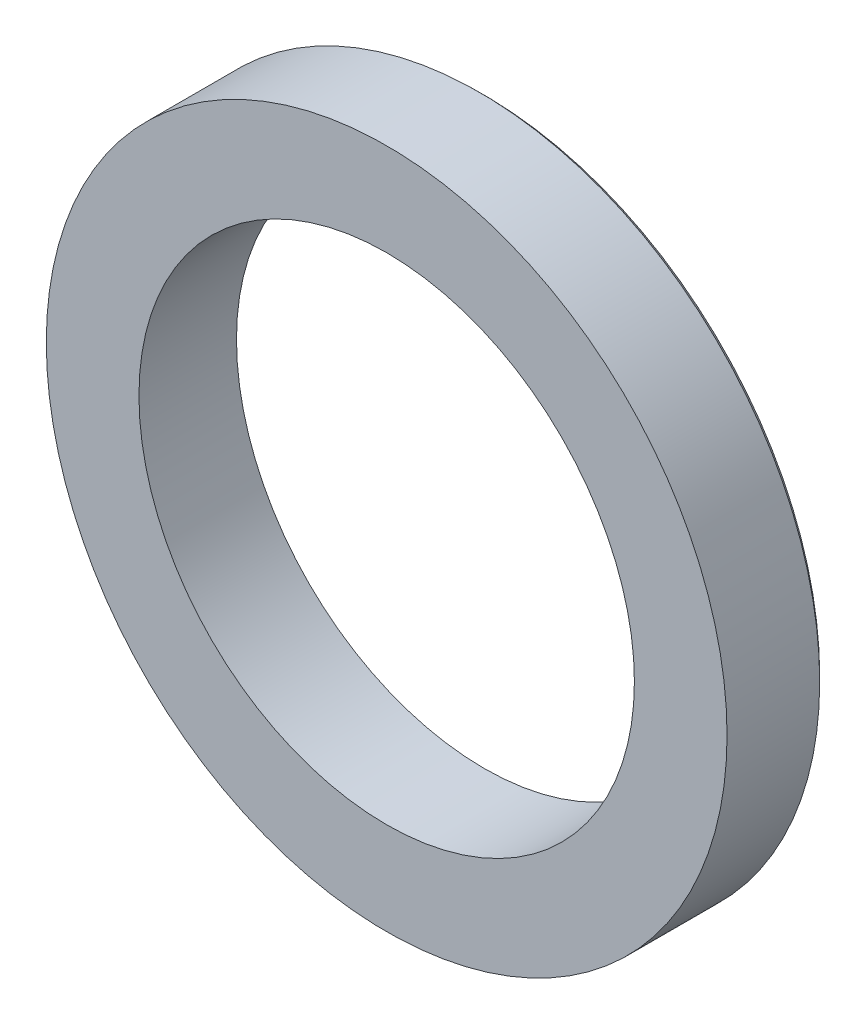
from build123d import *

# Parameters (mm, degrees)
SKETCH1_R           = 17.45
BOSS_EXTRUDE1_DEPTH = 5
SKETCH2_R           = 12.65
BOSS_EXTRUDE2_DEPTH = 6.3
SKETCH3_R           = 12.7
CUT_EXTRUDE1_DEPTH  = 28.14212593
CHAMFER3_SIZE       = 0.25


with BuildPart() as part:
    # Sketch1 → Boss-Extrude1 (new body)
    with BuildSketch(Plane.XY):
        Circle(SKETCH1_R)
    extrude(amount=BOSS_EXTRUDE1_DEPTH)

    # Sketch2 → Boss-Extrude2 (add)
    with BuildSketch(Plane(origin=(0, 0, 0), x_dir=(-1, 0, 0), z_dir=(0, 0, -1))):
        with Locations(Location((0, 0, 0), (0, 0, 180))):
            Circle(SKETCH2_R)
    extrude(amount=BOSS_EXTRUDE2_DEPTH)

    # Sketch3 → Cut-Extrude1 (cut, through all)
    with BuildSketch(Plane.XY.offset(5)):
        Circle(SKETCH3_R)
    extrude(amount=-CUT_EXTRUDE1_DEPTH, mode=Mode.SUBTRACT)

    # Chamfer3
    chamfer3_edges = [part.edges().sort_by_distance(p)[0] for p in [
        (-17.45, 0, 0),
    ]]
    chamfer(chamfer3_edges, length=CHAMFER3_SIZE)


solid = part.part
